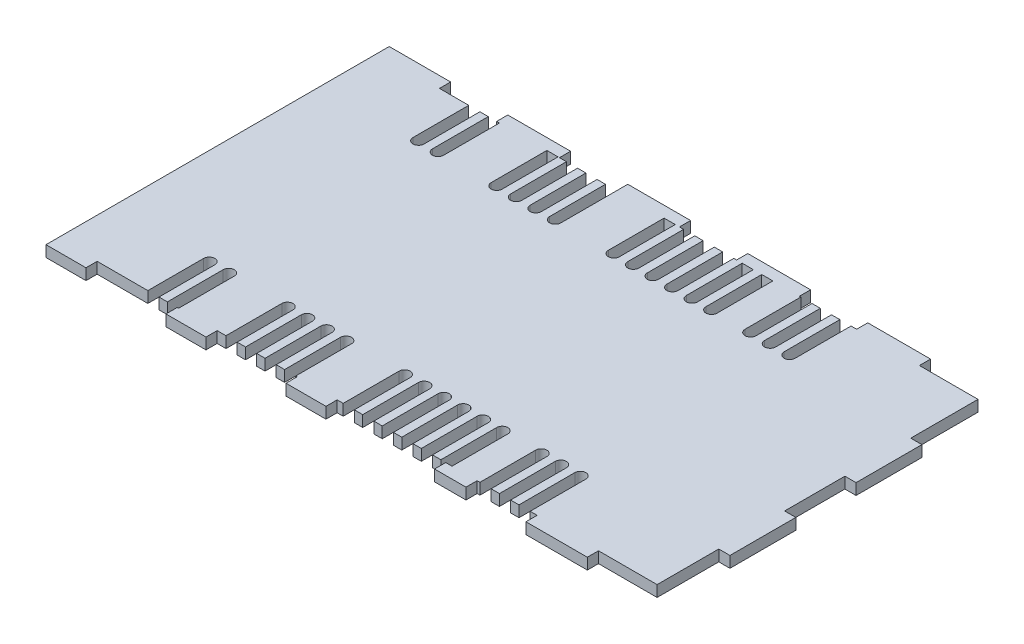
from build123d import *

# Parameters (mm, degrees)
SKETCH1_W           = 215
SKETCH1_H           = 115
BOSS_EXTRUDE1_DEPTH = 4
SKETCH2_W           = 21.5
SKETCH2_H           = 4
BOSS_EXTRUDE2_DEPTH = 4
SKETCH3_W           = 14.333333
SKETCH3_H           = 4
CUT_EXTRUDE1_DEPTH  = 4
SKETCH4_W           = 10.25
SKETCH4_H           = 4
CUT_EXTRUDE2_DEPTH  = 10
SKETCH5_W           = 4
SKETCH5_H           = 23.6
BOSS_EXTRUDE3_DEPTH = 4
SKETCH6_W           = 22.5
SKETCH6_H           = 4
SKETCH6_W_2         = 22
BOSS_EXTRUDE4_DEPTH = 4
CUT_EXTRUDE3_DEPTH  = 4
BOSS_EXTRUDE5_DEPTH = 4


with BuildPart() as part:
    # Sketch1 → Boss-Extrude1 (new body)
    with BuildSketch(Plane(origin=(0, 0, 0), x_dir=(1, 0, 0), z_dir=(0, 1, 0))):
        with Locations((107.5, 57.5)):
            Rectangle(SKETCH1_W, SKETCH1_H)
    extrude(amount=BOSS_EXTRUDE1_DEPTH)

    # Sketch2 → Boss-Extrude2 (add)
    with BuildSketch(Plane(origin=(0, 4, 0), x_dir=(1, 0, 0), z_dir=(0, 1, 0))):
        with Locations((53.75, -2)):
            Rectangle(SKETCH2_W, SKETCH2_H)
        with Locations((10.75, -2)):
            Rectangle(SKETCH2_W, SKETCH2_H)
        with Locations((96.75, -2)):
            Rectangle(SKETCH2_W, SKETCH2_H)
        with Locations((139.75, -2)):
            Rectangle(SKETCH2_W, SKETCH2_H)
        Polygon((172, -4), (172, 0), (193.5, 0), (194, 0), (194, -4), (193.5, -4), align=None)
    extrude(amount=-BOSS_EXTRUDE2_DEPTH)

    # Sketch3 → Cut-Extrude1 (cut)
    with BuildSketch(Plane(origin=(0, 4, 0), x_dir=(1, 0, 0), z_dir=(0, 1, 0))):
        with Locations((64.4966665, -2)):
            Rectangle(SKETCH3_W, SKETCH3_H)
        with Locations((21.4966665, -2)):
            Rectangle(SKETCH3_W, SKETCH3_H)
        with Locations((107.4966665, -2)):
            Rectangle(SKETCH3_W, SKETCH3_H)
    extrude(amount=-CUT_EXTRUDE1_DEPTH, mode=Mode.SUBTRACT)

    # Sketch4 → Cut-Extrude2 (cut)
    with BuildSketch(Plane(origin=(0, 4, 0), x_dir=(1, 0, 0), z_dir=(0, 1, 0))):
        with Locations((134.125, -2)):
            Rectangle(SKETCH4_W, SKETCH4_H)
    extrude(amount=-CUT_EXTRUDE2_DEPTH, mode=Mode.SUBTRACT)

    # Sketch5 → Boss-Extrude3 (add)
    with BuildSketch(Plane.XZ):
        with Locations((217, -33.9)):
            Rectangle(SKETCH5_W, SKETCH5_H)
        with Locations((217, -79.1)):
            Rectangle(SKETCH5_W, SKETCH5_H)
    extrude(amount=-BOSS_EXTRUDE3_DEPTH)

    # Sketch6 → Boss-Extrude4 (add)
    with BuildSketch(Plane.XZ):
        with Locations((182.75, -117)):
            Rectangle(SKETCH6_W, SKETCH6_H)
        with Locations((139.75, -117)):
            Rectangle(SKETCH6_W, SKETCH6_H)
        with Locations((96.75, -117)):
            Rectangle(SKETCH6_W, SKETCH6_H)
        with Locations((53.75, -117)):
            Rectangle(SKETCH6_W, SKETCH6_H)
        with Locations((11, -117)):
            Rectangle(SKETCH6_W_2, SKETCH6_H)
    extrude(amount=-BOSS_EXTRUDE4_DEPTH)

    # Sketch7 → Cut-Extrude3 (cut)
    with BuildSketch(Plane(origin=(0, 0, 0), x_dir=(-1, 0, 0), z_dir=(0, -1, 0))):
        with BuildLine():
            Line((-120.499607667, 0), (-116.499607667, 0))
            Line((-116.499607667, 0), (-116.499607667, 20))
            ThreePointArc((-116.499607667, 20), (-118.499607667, 22), (-120.499607667, 20))
            Line((-120.499607667, 20), (-120.499607667, 0))
        make_face()
        with BuildLine():
            Line((-32.499607667, 95), (-32.499607667, 115))
            Line((-32.499607667, 115), (-36.499607667, 115))
            Line((-36.499607667, 115), (-36.499607667, 95))
            ThreePointArc((-36.499607667, 95), (-34.499607667, 93), (-32.499607667, 95))
        make_face()
        with BuildLine():
            Line((-127.499607667, 20), (-127.499607667, 0))
            Line((-127.499607667, 0), (-123.499607667, 0))
            Line((-123.499607667, 0), (-123.499607667, 20))
            ThreePointArc((-123.499607667, 20), (-125.499607667, 22), (-127.499607667, 20))
        make_face()
        with BuildLine():
            Line((-134.499607667, 20), (-134.499607667, 0))
            Line((-134.499607667, 0), (-130.499607667, 0))
            Line((-130.499607667, 0), (-130.499607667, 20))
            ThreePointArc((-130.499607667, 20), (-132.499607667, 22), (-134.499607667, 20))
        make_face()
        with BuildLine():
            Line((-141.499607667, 20), (-141.499607667, 0))
            Line((-141.499607667, 0), (-137.499607667, 0))
            Line((-137.499607667, 0), (-137.499607667, 20))
            ThreePointArc((-137.499607667, 20), (-139.499607667, 22), (-141.499607667, 20))
        make_face()
        with BuildLine():
            Line((-148.499607667, 20), (-148.499607667, 0))
            Line((-148.499607667, 0), (-144.499607667, 0))
            Line((-144.499607667, 0), (-144.499607667, 20))
            ThreePointArc((-144.499607667, 20), (-146.499607667, 22), (-148.499607667, 20))
        make_face()
        with BuildLine():
            Line((-155.499607667, 20), (-155.499607667, 0))
            Line((-155.499607667, 0), (-151.499607667, 0))
            Line((-151.499607667, 0), (-151.499607667, 20))
            ThreePointArc((-151.499607667, 20), (-153.499607667, 22), (-155.499607667, 20))
        make_face()
        with BuildLine():
            Line((-162.499607667, 20), (-162.499607667, 0))
            Line((-162.499607667, 0), (-158.499607667, 0))
            Line((-158.499607667, 0), (-158.499607667, 20))
            ThreePointArc((-158.499607667, 20), (-160.499607667, 22), (-162.499607667, 20))
        make_face()
        with BuildLine():
            Line((-169.499607667, 20), (-169.499607667, 0))
            Line((-169.499607667, 0), (-165.499607667, 0))
            Line((-165.499607667, 0), (-165.499607667, 20))
            ThreePointArc((-165.499607667, 20), (-167.499607667, 22), (-169.499607667, 20))
        make_face()
        with BuildLine():
            Line((-176.499607667, 20), (-176.499607667, 0))
            Line((-176.499607667, 0), (-172.499607667, 0))
            Line((-172.499607667, 0), (-172.499607667, 20))
            ThreePointArc((-172.499607667, 20), (-174.499607667, 22), (-176.499607667, 20))
        make_face()
        with BuildLine():
            Line((-113.499607667, 20), (-113.499607667, 0))
            Line((-113.499607667, 0), (-109.499607667, 0))
            Line((-109.499607667, 0), (-109.499607667, 20))
            ThreePointArc((-109.499607667, 20), (-111.499607667, 22), (-113.499607667, 20))
        make_face()
        with BuildLine():
            Line((-106.499607667, 20), (-106.499607667, 0))
            Line((-106.499607667, 0), (-102.499607667, 0))
            Line((-102.499607667, 0), (-102.499607667, 20))
            ThreePointArc((-102.499607667, 20), (-104.499607667, 22), (-106.499607667, 20))
        make_face()
        with BuildLine():
            Line((-99.499607667, 20), (-99.499607667, 0))
            Line((-99.499607667, 0), (-95.499607667, 0))
            Line((-95.499607667, 0), (-95.499607667, 20))
            ThreePointArc((-95.499607667, 20), (-97.499607667, 22), (-99.499607667, 20))
        make_face()
        with BuildLine():
            Line((-92.499607667, 20), (-92.499607667, 0))
            Line((-92.499607667, 0), (-88.499607667, 0))
            Line((-88.499607667, 0), (-88.499607667, 20))
            ThreePointArc((-88.499607667, 20), (-90.499607667, 22), (-92.499607667, 20))
        make_face()
        with BuildLine():
            Line((-85.499607667, 20), (-85.499607667, 0))
            Line((-85.499607667, 0), (-81.499607667, 0))
            Line((-81.499607667, 0), (-81.499607667, 20))
            ThreePointArc((-81.499607667, 20), (-83.499607667, 22), (-85.499607667, 20))
        make_face()
        with BuildLine():
            Line((-78.499607667, 20), (-78.499607667, 0))
            Line((-78.499607667, 0), (-74.499607667, 0))
            Line((-74.499607667, 0), (-74.499607667, 20))
            ThreePointArc((-74.499607667, 20), (-76.499607667, 22), (-78.499607667, 20))
        make_face()
        with BuildLine():
            Line((-71.499607667, 20), (-71.499607667, 0))
            Line((-71.499607667, 0), (-67.499607667, 0))
            Line((-67.499607667, 0), (-67.499607667, 20))
            ThreePointArc((-67.499607667, 20), (-69.499607667, 22), (-71.499607667, 20))
        make_face()
        with BuildLine():
            Line((-64.499607667, 20), (-64.499607667, 0))
            Line((-64.499607667, 0), (-60.499607667, 0))
            Line((-60.499607667, 0), (-60.499607667, 20))
            ThreePointArc((-60.499607667, 20), (-62.499607667, 22), (-64.499607667, 20))
        make_face()
        with BuildLine():
            Line((-57.499607667, 20), (-57.499607667, 0))
            Line((-57.499607667, 0), (-53.499607667, 0))
            Line((-53.499607667, 0), (-53.499607667, 20))
            ThreePointArc((-53.499607667, 20), (-55.499607667, 22), (-57.499607667, 20))
        make_face()
        with BuildLine():
            Line((-50.499607667, 20), (-50.499607667, 0))
            Line((-50.499607667, 0), (-46.499607667, 0))
            Line((-46.499607667, 0), (-46.499607667, 20))
            ThreePointArc((-46.499607667, 20), (-48.499607667, 22), (-50.499607667, 20))
        make_face()
        with BuildLine():
            Line((-43.499607667, 20), (-43.499607667, 0))
            Line((-43.499607667, 0), (-39.499607667, 0))
            Line((-39.499607667, 0), (-39.499607667, 20))
            ThreePointArc((-39.499607667, 20), (-41.499607667, 22), (-43.499607667, 20))
        make_face()
        with BuildLine():
            Line((-183.499607667, 20), (-183.499607667, 0))
            Line((-183.499607667, 0), (-179.499607667, 0))
            Line((-179.499607667, 0), (-179.499607667, 20))
            ThreePointArc((-179.499607667, 20), (-181.499607667, 22), (-183.499607667, 20))
        make_face()
        with BuildLine():
            Line((-36.499607667, 20), (-36.499607667, 0))
            Line((-36.499607667, 0), (-32.499607667, 0))
            Line((-32.499607667, 0), (-32.499607667, 20))
            ThreePointArc((-32.499607667, 20), (-34.499607667, 22), (-36.499607667, 20))
        make_face()
        with BuildLine():
            Line((-179.499607667, 95), (-179.499607667, 115))
            Line((-179.499607667, 115), (-183.499607667, 115))
            Line((-183.499607667, 115), (-183.499607667, 95))
            ThreePointArc((-183.499607667, 95), (-181.499607667, 93), (-179.499607667, 95))
        make_face()
        with BuildLine():
            Line((-39.499607667, 95), (-39.499607667, 115))
            Line((-39.499607667, 115), (-43.499607667, 115))
            Line((-43.499607667, 115), (-43.499607667, 95))
            ThreePointArc((-43.499607667, 95), (-41.499607667, 93), (-39.499607667, 95))
        make_face()
        with BuildLine():
            Line((-46.499607667, 95), (-46.499607667, 115))
            Line((-46.499607667, 115), (-50.499607667, 115))
            Line((-50.499607667, 115), (-50.499607667, 95))
            ThreePointArc((-50.499607667, 95), (-48.499607667, 93), (-46.499607667, 95))
        make_face()
        with BuildLine():
            Line((-53.499607667, 95), (-53.499607667, 115))
            Line((-53.499607667, 115), (-57.499607667, 115))
            Line((-57.499607667, 115), (-57.499607667, 95))
            ThreePointArc((-57.499607667, 95), (-55.499607667, 93), (-53.499607667, 95))
        make_face()
        with BuildLine():
            Line((-60.499607667, 95), (-60.499607667, 115))
            Line((-60.499607667, 115), (-64.499607667, 115))
            Line((-64.499607667, 115), (-64.499607667, 95))
            ThreePointArc((-64.499607667, 95), (-62.499607667, 93), (-60.499607667, 95))
        make_face()
        with BuildLine():
            Line((-67.499607667, 95), (-67.499607667, 115))
            Line((-67.499607667, 115), (-71.499607667, 115))
            Line((-71.499607667, 115), (-71.499607667, 95))
            ThreePointArc((-71.499607667, 95), (-69.499607667, 93), (-67.499607667, 95))
        make_face()
        with BuildLine():
            Line((-74.499607667, 95), (-74.499607667, 115))
            Line((-74.499607667, 115), (-78.499607667, 115))
            Line((-78.499607667, 115), (-78.499607667, 95))
            ThreePointArc((-78.499607667, 95), (-76.499607667, 93), (-74.499607667, 95))
        make_face()
        with BuildLine():
            Line((-81.499607667, 95), (-81.499607667, 115))
            Line((-81.499607667, 115), (-85.499607667, 115))
            Line((-85.499607667, 115), (-85.499607667, 95))
            ThreePointArc((-85.499607667, 95), (-83.499607667, 93), (-81.499607667, 95))
        make_face()
        with BuildLine():
            Line((-88.499607667, 95), (-88.499607667, 115))
            Line((-88.499607667, 115), (-92.499607667, 115))
            Line((-92.499607667, 115), (-92.499607667, 95))
            ThreePointArc((-92.499607667, 95), (-90.499607667, 93), (-88.499607667, 95))
        make_face()
        with BuildLine():
            Line((-95.499607667, 95), (-95.499607667, 115))
            Line((-95.499607667, 115), (-99.499607667, 115))
            Line((-99.499607667, 115), (-99.499607667, 95))
            ThreePointArc((-99.499607667, 95), (-97.499607667, 93), (-95.499607667, 95))
        make_face()
        with BuildLine():
            Line((-102.499607667, 95), (-102.499607667, 115))
            Line((-102.499607667, 115), (-106.499607667, 115))
            Line((-106.499607667, 115), (-106.499607667, 95))
            ThreePointArc((-106.499607667, 95), (-104.499607667, 93), (-102.499607667, 95))
        make_face()
        with BuildLine():
            Line((-109.499607667, 95), (-109.499607667, 115))
            Line((-109.499607667, 115), (-113.499607667, 115))
            Line((-113.499607667, 115), (-113.499607667, 95))
            ThreePointArc((-113.499607667, 95), (-111.499607667, 93), (-109.499607667, 95))
        make_face()
        with BuildLine():
            Line((-172.499607667, 95), (-172.499607667, 115))
            Line((-172.499607667, 115), (-176.499607667, 115))
            Line((-176.499607667, 115), (-176.499607667, 95))
            ThreePointArc((-176.499607667, 95), (-174.499607667, 93), (-172.499607667, 95))
        make_face()
        with BuildLine():
            Line((-165.499607667, 95), (-165.499607667, 115))
            Line((-165.499607667, 115), (-169.499607667, 115))
            Line((-169.499607667, 115), (-169.499607667, 95))
            ThreePointArc((-169.499607667, 95), (-167.499607667, 93), (-165.499607667, 95))
        make_face()
        with BuildLine():
            Line((-158.499607667, 95), (-158.499607667, 115))
            Line((-158.499607667, 115), (-162.499607667, 115))
            Line((-162.499607667, 115), (-162.499607667, 95))
            ThreePointArc((-162.499607667, 95), (-160.499607667, 93), (-158.499607667, 95))
        make_face()
        with BuildLine():
            Line((-151.499607667, 95), (-151.499607667, 115))
            Line((-151.499607667, 115), (-155.499607667, 115))
            Line((-155.499607667, 115), (-155.499607667, 95))
            ThreePointArc((-155.499607667, 95), (-153.499607667, 93), (-151.499607667, 95))
        make_face()
        with BuildLine():
            Line((-144.499607667, 95), (-144.499607667, 115))
            Line((-144.499607667, 115), (-148.499607667, 115))
            Line((-148.499607667, 115), (-148.499607667, 95))
            ThreePointArc((-148.499607667, 95), (-146.499607667, 93), (-144.499607667, 95))
        make_face()
        with BuildLine():
            Line((-137.499607667, 95), (-137.499607667, 115))
            Line((-137.499607667, 115), (-141.499607667, 115))
            Line((-141.499607667, 115), (-141.499607667, 95))
            ThreePointArc((-141.499607667, 95), (-139.499607667, 93), (-137.499607667, 95))
        make_face()
        with BuildLine():
            Line((-130.499607667, 95), (-130.499607667, 115))
            Line((-130.499607667, 115), (-134.499607667, 115))
            Line((-134.499607667, 115), (-134.499607667, 95))
            ThreePointArc((-134.499607667, 95), (-132.499607667, 93), (-130.499607667, 95))
        make_face()
        with BuildLine():
            Line((-123.499607667, 95), (-123.499607667, 115))
            Line((-123.499607667, 115), (-127.499607667, 115))
            Line((-127.499607667, 115), (-127.499607667, 95))
            ThreePointArc((-127.499607667, 95), (-125.499607667, 93), (-123.499607667, 95))
        make_face()
        with BuildLine():
            Line((-120.499607667, 95), (-120.499607667, 115))
            Line((-120.499607667, 115), (-116.499607667, 115))
            Line((-116.499607667, 115), (-116.499607667, 95))
            ThreePointArc((-116.499607667, 95), (-118.499607667, 93), (-120.499607667, 95))
        make_face()
    extrude(amount=-CUT_EXTRUDE3_DEPTH, mode=Mode.SUBTRACT)

    # Sketch8 → Boss-Extrude5 (add)
    with BuildSketch(Plane.XZ):
        with BuildLine():
            Line((46.499607667, 0), (46.499607667, -20))
            ThreePointArc((46.499607667, -20), (48.499607667, -22), (50.499607667, -20))
            Line((50.499607667, -20), (50.499607667, 0))
            Line((50.499607667, 0), (46.499607667, 0))
        make_face()
        with BuildLine():
            Line((57.33, 0), (53.499607667, 0))
            Line((53.499607667, 0), (53.499607667, -20))
            ThreePointArc((53.499607667, -20), (55.499607667, -22), (57.499607667, -20))
            Line((57.499607667, -20), (57.499607667, 0))
            Line((57.499607667, 0), (57.33, 0))
        make_face()
        with BuildLine():
            Line((99.499607667, -20), (99.499607667, 0))
            Line((99.499607667, 0), (95.499607667, 0))
            Line((95.499607667, 0), (95.499607667, -20))
            ThreePointArc((95.499607667, -20), (97.499607667, -22), (99.499607667, -20))
        make_face()
        with BuildLine():
            Line((92.499607667, 0), (88.499607667, 0))
            Line((88.499607667, 0), (88.499607667, -20))
            ThreePointArc((88.499607667, -20), (90.499607667, -22), (92.499607667, -20))
            Line((92.499607667, -20), (92.499607667, 0))
        make_face()
        with BuildLine():
            Line((148.499607667, -20), (148.499607667, 0))
            Line((148.499607667, 0), (144.499607667, 0))
            Line((144.499607667, 0), (144.499607667, -20))
            ThreePointArc((144.499607667, -20), (146.499607667, -22), (148.499607667, -20))
        make_face()
        with BuildLine():
            Line((183.499607667, 0), (179.499607667, 0))
            Line((179.499607667, 0), (179.499607667, -20))
            ThreePointArc((179.499607667, -20), (181.499607667, -22), (183.499607667, -20))
            Line((183.499607667, -20), (183.499607667, 0))
        make_face()
        with BuildLine():
            Line((176.499607667, -20), (176.499607667, 0))
            Line((176.499607667, 0), (172.499607667, 0))
            Line((172.499607667, 0), (172.499607667, -20))
            ThreePointArc((172.499607667, -20), (174.499607667, -22), (176.499607667, -20))
        make_face()
        with BuildLine():
            Line((172.499607667, -115), (172.499607667, -95))
            ThreePointArc((172.499607667, -95), (174.499607667, -93), (176.499607667, -95))
            Line((176.499607667, -95), (176.499607667, -115))
            Line((176.499607667, -115), (172.499607667, -115))
        make_face()
        with BuildLine():
            Line((179.499607667, -115), (179.499607667, -95))
            ThreePointArc((179.499607667, -95), (181.499607667, -93), (183.499607667, -95))
            Line((183.499607667, -95), (183.499607667, -115))
            Line((183.499607667, -115), (179.499607667, -115))
        make_face()
        with BuildLine():
            Line((144.499607667, -115), (144.499607667, -95))
            ThreePointArc((144.499607667, -95), (146.499607667, -93), (148.499607667, -95))
            Line((148.499607667, -95), (148.499607667, -115))
            Line((148.499607667, -115), (144.499607667, -115))
        make_face()
        with BuildLine():
            Line((92.499607667, -95), (92.499607667, -115))
            Line((92.499607667, -115), (88.499607667, -115))
            Line((88.499607667, -115), (88.499607667, -95))
            ThreePointArc((88.499607667, -95), (90.499607667, -93), (92.499607667, -95))
        make_face()
        with BuildLine():
            Line((99.499607667, -115), (95.499607667, -115))
            Line((95.499607667, -115), (95.499607667, -95))
            ThreePointArc((95.499607667, -95), (97.499607667, -93), (99.499607667, -95))
            Line((99.499607667, -95), (99.499607667, -115))
        make_face()
        with BuildLine():
            Line((57.33, -115), (57.499607667, -115))
            Line((57.499607667, -115), (57.499607667, -95))
            ThreePointArc((57.499607667, -95), (55.499607667, -93), (53.499607667, -95))
            Line((53.499607667, -95), (53.499607667, -115))
            Line((53.499607667, -115), (57.33, -115))
        make_face()
        with BuildLine():
            Line((50.499607667, -95), (50.499607667, -115))
            Line((50.499607667, -115), (46.499607667, -115))
            Line((46.499607667, -115), (46.499607667, -95))
            ThreePointArc((46.499607667, -95), (48.499607667, -93), (50.499607667, -95))
        make_face()
    extrude(amount=-BOSS_EXTRUDE5_DEPTH)


solid = part.part
